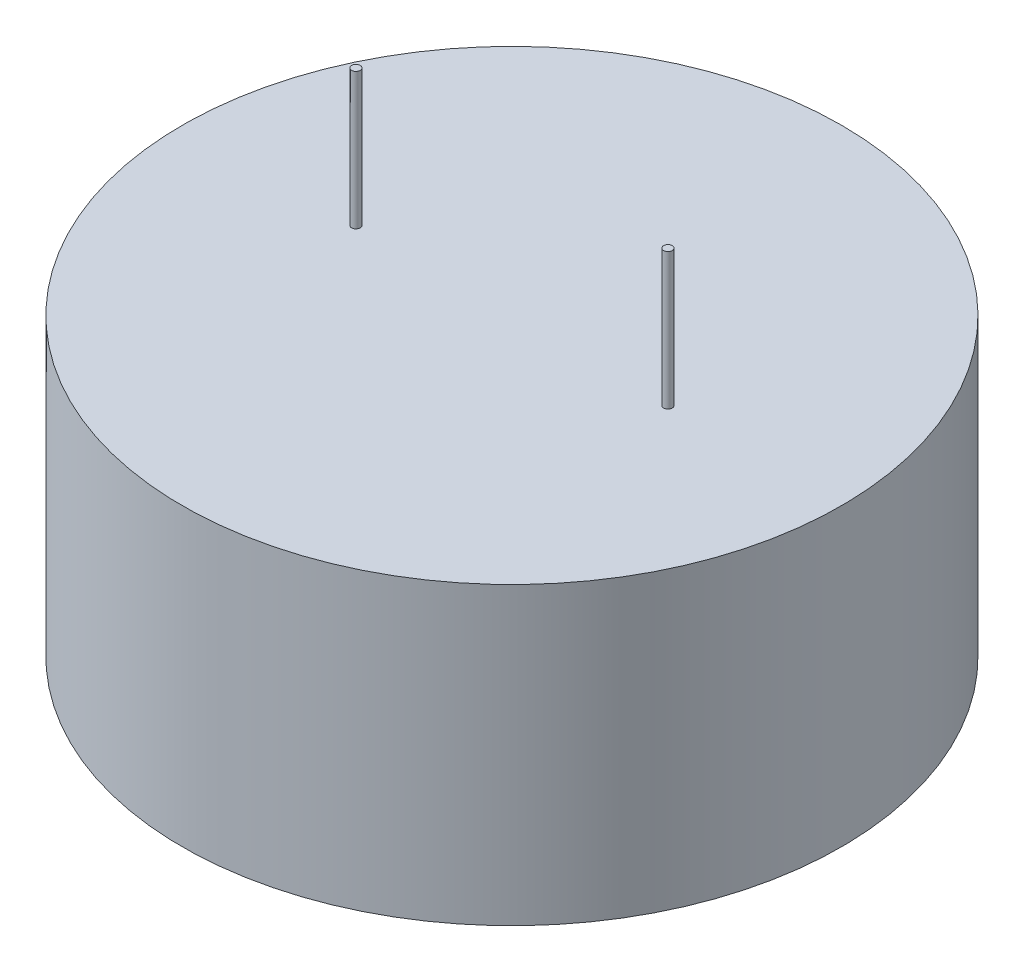
from build123d import *

# Parameters (mm, degrees)
ESQUISSE1_R        = 14.5
BOSS_EXTRU_1_DEPTH = 13
ESQUISSE2_R        = 0.190045057
BOSS_EXTRU_2_DEPTH = 6


with BuildPart() as part:
    # Esquisse1 → Boss.-Extru.1 (new body)
    with BuildSketch(Plane(origin=(0, 0, 0), x_dir=(1, 0, 0), z_dir=(0, 1, 0))):
        with Locations(Location((0, 0, 0), (0, 0, 90))):
            Circle(ESQUISSE1_R)
    extrude(amount=BOSS_EXTRU_1_DEPTH)

    # Esquisse2 → Boss.-Extru.2 (add)
    with BuildSketch(Plane(origin=(0, 13, 0), x_dir=(1, 0, 0), z_dir=(0, 1, 0))):
        with Locations(Location((-6.864876716, 0, 0), (0, 0, 270))):
            Circle(ESQUISSE2_R)
    boss_extru_2 = extrude(amount=BOSS_EXTRU_2_DEPTH)

    # Symétrie1: Boss.-Extru.2 across plane
    add(boss_extru_2.mirror(Plane(origin=(0, 0, 0), x_dir=(0, 0, 1), z_dir=(1, 0, 0))))


solid = part.part
